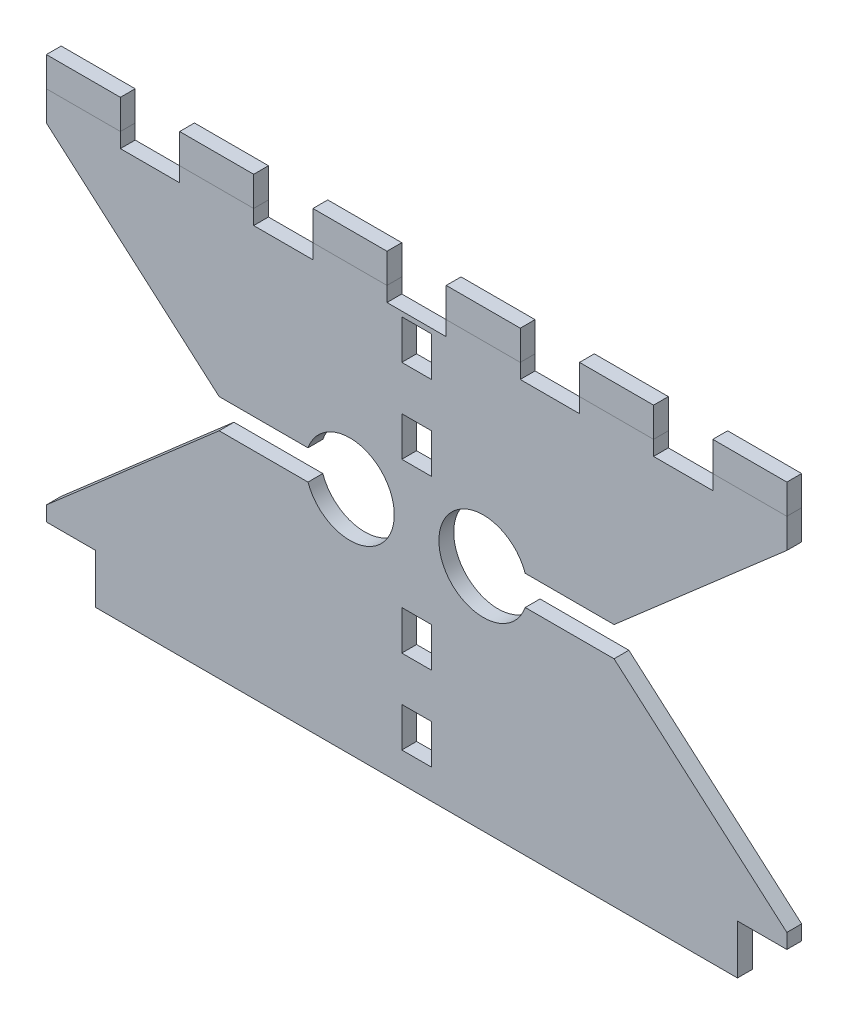
from build123d import *

# Parameters (mm, degrees)
BOSS_EXTRU_1_DEPTH      = 3
ESQUISSE2_W             = 15
ESQUISSE2_H             = 3
BOSS_EXTRU_2_DEPTH      = 3
ESQUISSE3_W             = 15
ESQUISSE3_H             = 6
BOSS_EXTRU_3_DEPTH      = 3
BOSS_EXTRU_3_2_DEPTH    = 3
BOSS_EXTRU_3_3_DEPTH    = 3
BOSS_EXTRU_3_4_DEPTH    = 3
BOSS_EXTRU_3_5_DEPTH    = 3
BOSS_EXTRU_3_6_DEPTH    = 3
ESQUISSE4_W             = 6
ESQUISSE4_H             = 8
ENL_V_MAT_EXTRU_1_DEPTH = 3


with BuildPart() as part:
    # Esquisse1 → Boss.-Extru.1 (new body)
    with BuildSketch(Plane.XY):
        with BuildLine():
            Line((-164.475700203, 83.618467297), (-164.475700203, 80.618467297))
            Line((-164.475700203, 80.618467297), (-129.475700203, 50.118467297))
            Line((-129.475700203, 50.118467297), (-111.475700203, 50.118467297))
            ThreePointArc((-111.475700203, 50.118467297), (-101.468501021, 55.988854334), (-93.990418829, 47.118467297))
            ThreePointArc((-93.990418829, 47.118467297), (-101.468501021, 38.24808026), (-111.475700203, 44.118467297))
            Line((-111.475700203, 44.118467297), (-129.475700203, 44.118467297))
            Line((-129.475700203, 44.118467297), (-164.475700203, 13.618467297))
            Line((-164.475700203, 13.618467297), (-164.475700203, 10.618467297))
            Line((-164.475700203, 10.618467297), (-154.475700203, 10.618467297))
            Line((-154.475700203, 10.618467297), (-154.475700203, 0.618467297))
            Line((-154.475700203, 0.618467297), (-24.475700203, 0.618467297))
            Line((-24.475700203, 0.618467297), (-24.475700203, 10.618467297))
            Line((-24.475700203, 10.618467297), (-14.475700203, 10.618467297))
            Line((-14.475700203, 10.618467297), (-14.475700203, 13.618467297))
            Line((-14.475700203, 13.618467297), (-49.475700203, 44.118467297))
            Line((-49.475700203, 44.118467297), (-67.475700203, 44.118467297))
            ThreePointArc((-67.475700203, 44.118467297), (-84.960981578, 47.118467297), (-67.475700203, 50.118467297))
            Line((-67.475700203, 50.118467297), (-49.475700203, 50.118467297))
            Line((-49.475700203, 50.118467297), (-14.475700203, 80.618467297))
            Line((-14.475700203, 80.618467297), (-14.475700203, 83.618467297))
            Line((-14.475700203, 83.618467297), (-164.475700203, 83.618467297))
        make_face()
    extrude(amount=BOSS_EXTRU_1_DEPTH)

    # Esquisse2 → Boss.-Extru.2 (add)
    with BuildSketch(Plane.XY.offset(3)):
        with Locations((-156.975700203, 85.118467297)):
            Rectangle(ESQUISSE2_W, ESQUISSE2_H)
        with Locations((-129.975700203, 85.118467297)):
            Rectangle(ESQUISSE2_W, ESQUISSE2_H)
        with Locations((-102.975700203, 85.118467297)):
            Rectangle(ESQUISSE2_W, ESQUISSE2_H)
        with Locations((-75.975700203, 85.118467297)):
            Rectangle(ESQUISSE2_W, ESQUISSE2_H)
        with Locations((-48.975700203, 85.118467297)):
            Rectangle(ESQUISSE2_W, ESQUISSE2_H)
        with Locations((-21.975700203, 85.118467297)):
            Rectangle(ESQUISSE2_W, ESQUISSE2_H)
    extrude(amount=-BOSS_EXTRU_2_DEPTH)

    # Esquisse4 → Enlèv. mat.-Extru.1 (cut)
    with BuildSketch(Plane.XY.offset(3)):
        with Locations((-89.475700203, 78.618467297)):
            Rectangle(ESQUISSE4_W, ESQUISSE4_H)
        with Locations((-89.475700203, 61.618467297)):
            Rectangle(ESQUISSE4_W, ESQUISSE4_H)
        with Locations((-89.475700203, 27.618467297)):
            Rectangle(ESQUISSE4_W, ESQUISSE4_H)
        with Locations((-89.475700203, 10.618467297)):
            Rectangle(ESQUISSE4_W, ESQUISSE4_H)
    extrude(amount=-ENL_V_MAT_EXTRU_1_DEPTH, mode=Mode.SUBTRACT)


with BuildPart() as body_2:
    # Esquisse3 → Boss.-Extru.3 (new body)
    with BuildSketch(Plane.XY.offset(3)):
        with Locations((-156.975700203, 89.618467297)):
            Rectangle(ESQUISSE3_W, ESQUISSE3_H)
    extrude(amount=-BOSS_EXTRU_3_DEPTH)


with BuildPart() as body_3:
    # Esquisse3 → Boss.-Extru.3 2 (new body)
    with BuildSketch(Plane.XY.offset(3)):
        with Locations((-129.975700203, 89.618467297)):
            Rectangle(ESQUISSE3_W, ESQUISSE3_H)
    extrude(amount=-BOSS_EXTRU_3_2_DEPTH)


with BuildPart() as body_4:
    # Esquisse3 → Boss.-Extru.3 3 (new body)
    with BuildSketch(Plane.XY.offset(3)):
        with Locations((-102.975700203, 89.618467297)):
            Rectangle(ESQUISSE3_W, ESQUISSE3_H)
    extrude(amount=-BOSS_EXTRU_3_3_DEPTH)


with BuildPart() as body_5:
    # Esquisse3 → Boss.-Extru.3 4 (new body)
    with BuildSketch(Plane.XY.offset(3)):
        with Locations((-75.975700203, 89.618467297)):
            Rectangle(ESQUISSE3_W, ESQUISSE3_H)
    extrude(amount=-BOSS_EXTRU_3_4_DEPTH)


with BuildPart() as body_6:
    # Esquisse3 → Boss.-Extru.3 5 (new body)
    with BuildSketch(Plane.XY.offset(3)):
        with Locations((-48.975700203, 89.618467297)):
            Rectangle(ESQUISSE3_W, ESQUISSE3_H)
    extrude(amount=-BOSS_EXTRU_3_5_DEPTH)


with BuildPart() as body_7:
    # Esquisse3 → Boss.-Extru.3 6 (new body)
    with BuildSketch(Plane.XY.offset(3)):
        with Locations((-21.975700203, 89.618467297)):
            Rectangle(ESQUISSE3_W, ESQUISSE3_H)
    extrude(amount=-BOSS_EXTRU_3_6_DEPTH)


solid = Compound([part.part, body_2.part, body_3.part, body_4.part, body_5.part, body_6.part, body_7.part])
